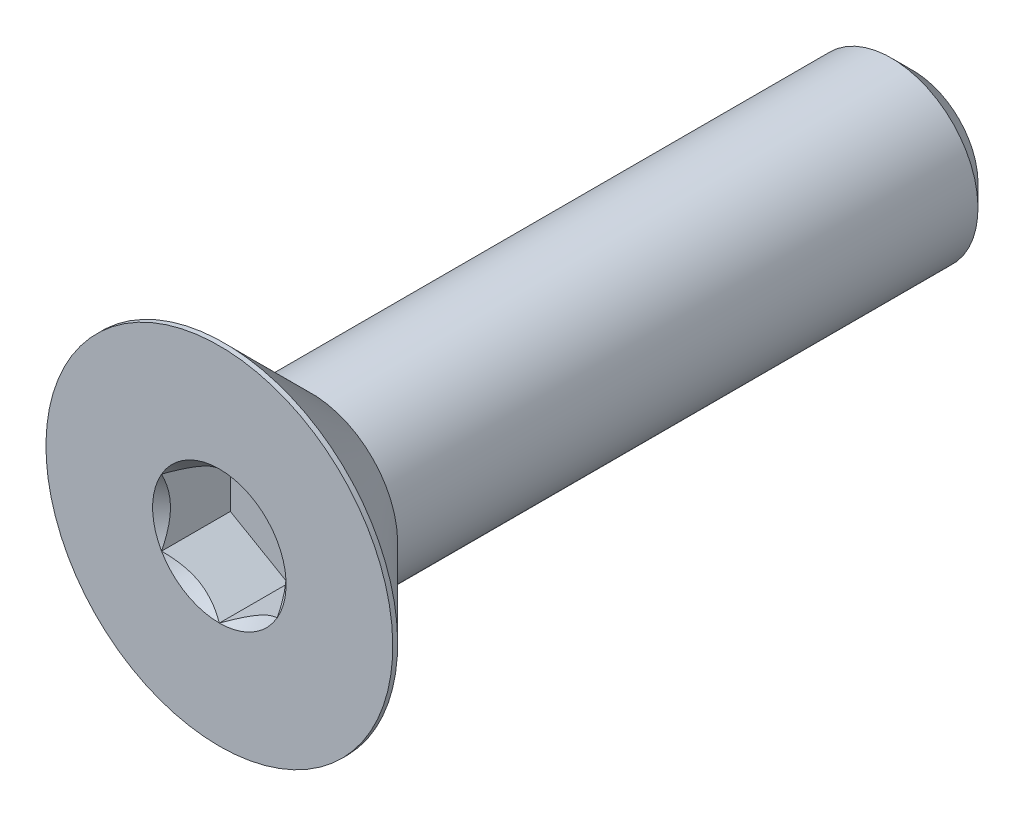
from build123d import *

# Parameters (mm, degrees)
CHAMFER1_SIZE      = 0.375
CUT_EXTRUDE2_DEPTH = 1.19


with BuildPart() as part:
    # Sketch1 → Revolve1 (revolve)
    with BuildSketch(Plane(origin=(0, 0, 0), x_dir=(0, 0, -1), z_dir=(1, 0, 0))):
        Polygon((-4.3, 1.5), (6, 1.5), (6, 0), (-4.81, 0), (-4.81, 1.5), align=None)
    revolve(axis=Axis((0, 0, 4.81), (0, 0, -1)))

    # Chamfer1
    chamfer1_edges = [part.edges().sort_by_distance(p)[0] for p in [
        (0, -1.5, -6),
    ]]
    chamfer(chamfer1_edges, length=CHAMFER1_SIZE)


with BuildPart() as body_2:
    # Sketch7 → Revolve2 (revolve)
    with BuildSketch(Plane(origin=(0, 0, 0), x_dir=(0, 0, -1), z_dir=(1, 0, 0))):
        Polygon((-5.915, 3), (-6, 3), (-6, 0), (-4.3, 0), (-4.3, 1.385), align=None)
    revolve(axis=Axis((0, 0, 6), (0, 0, -1)))

    # Sketch5 → Cut-Extrude2 (cut)
    with BuildSketch(Plane.XY.offset(6)):
        Polygon((1, -0.577350269), (1, 0.577350269), (0, 1.154700538), (-1, 0.577350269), (-1, -0.577350269), (0, -1.154700538), align=None)
    extrude(amount=-CUT_EXTRUDE2_DEPTH, mode=Mode.SUBTRACT)

    # Cut-Extrude3 cone 1 section (through the dimple's axis) → Cut-Extrude3 (revolve, cut)
    with BuildSketch(Plane(origin=(0, 0, 6), x_dir=(0, -1, 0), z_dir=(1, 0, 0))):
        Polygon((0, 0), (1.154700538, 0), (0, 1.154700538), align=None)
    revolve(axis=Axis((0, 0, 6), (0, 0, -1)), mode=Mode.SUBTRACT)

    # Combine1: union part
    add(part.part)


solid = body_2.part
